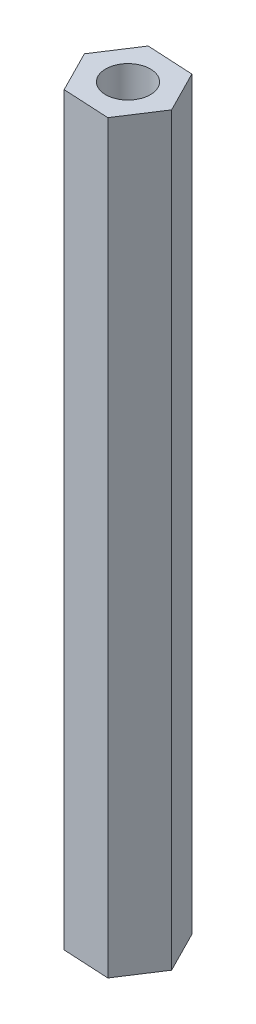
from build123d import *

# Parameters (mm, degrees)
EXTRUDE_1_DEPTH    = 55
HOLE_WIZARD_M4_1_D = 3.3


with BuildPart() as part:
    # 草图1 → 凸台-拉伸1 (new body)
    with BuildSketch(Plane(origin=(0, 0, 0), x_dir=(1, 0, 0), z_dir=(0, 1, 0))):
        Polygon((3.401504202, -0.181940922), (1.858317562, 2.854818589), (-1.54318664, 3.036759511), (-3.401504202, 0.181940922), (-1.858317562, -2.854818589), (1.54318664, -3.036759511), align=None)
    extrude(amount=EXTRUDE_1_DEPTH)

    # M4 螺纹孔1 (through all)
    with Locations(Plane(origin=(0, 55, 0), x_dir=(1, 0, 0), z_dir=(0, 1, 0))):
        with Locations((0, 0)):
            Hole(HOLE_WIZARD_M4_1_D / 2)


solid = part.part
